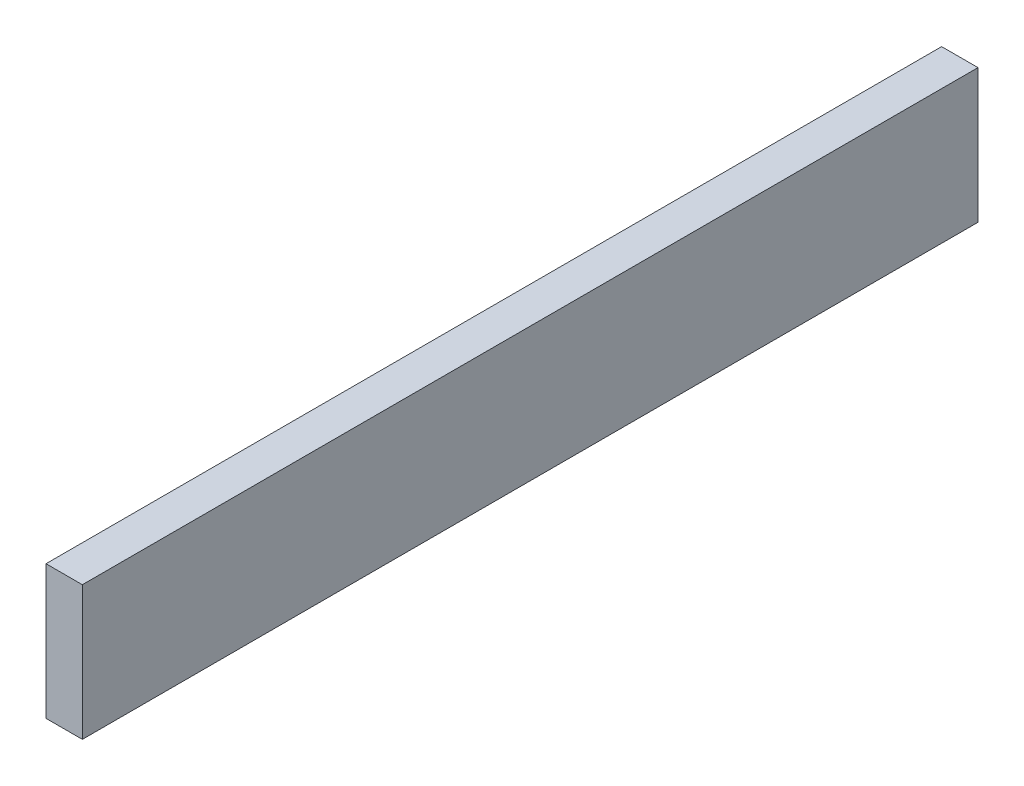
from build123d import *

# Parameters (mm, degrees)
SKETCH1_W           = 468
SKETCH1_H           = 70
BOSS_EXTRUDE1_DEPTH = 19


with BuildPart() as part:
    # Sketch1 → Boss-Extrude1 (new body)
    with BuildSketch(Plane(origin=(0, 0, 0), x_dir=(0, 0, -1), z_dir=(1, 0, 0))):
        with Locations((234, 35)):
            Rectangle(SKETCH1_W, SKETCH1_H)
    extrude(amount=BOSS_EXTRUDE1_DEPTH)


solid = part.part
